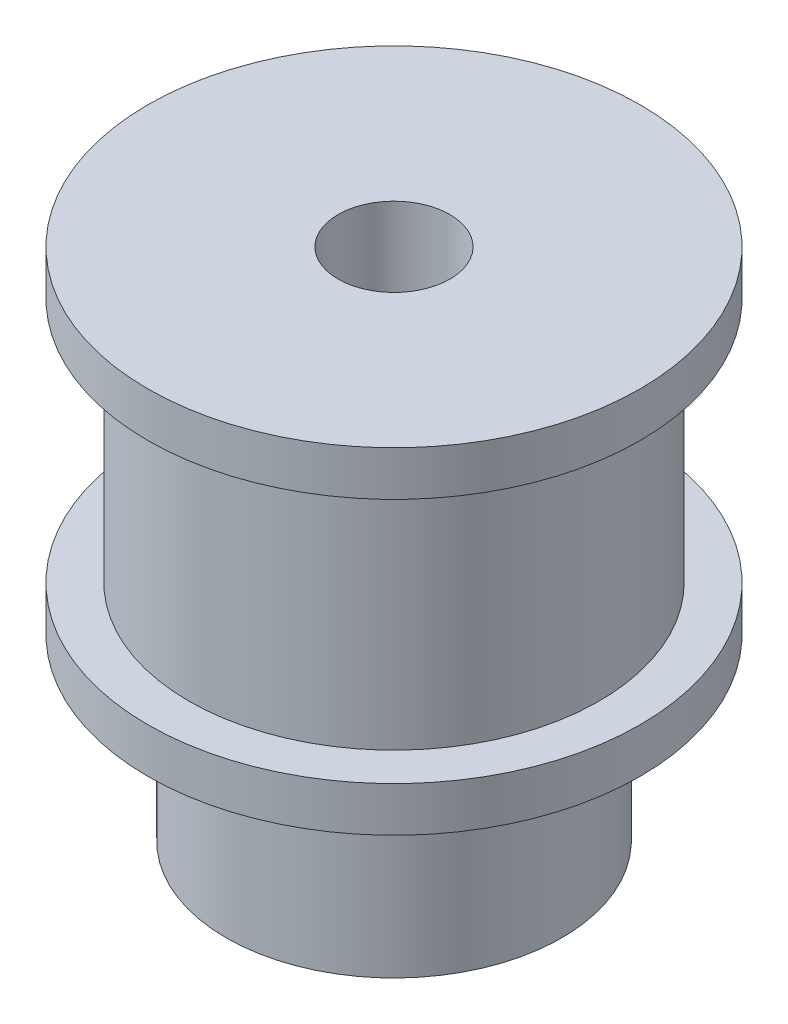
from build123d import *

# Parameters (mm, degrees)
SKETCH_1_R          = 11
EXTRUDE_1_DEPTH     = 2
SKETCH_2_R          = 9.17
EXTRUDE_2_DEPTH     = 11
SKETCH_3_R          = 11
EXTRUDE_3_DEPTH     = 2
SKETCH_4_R          = 2.5
CUT_EXTRUDE_1_DEPTH = 26
SKETCH_5_R          = 7.5
SKETCH_5_R_2        = 2.5
EXTRUDE_4_DEPTH     = 8


with BuildPart() as part:
    # 草图1 → 凸台-拉伸1 (new body)
    with BuildSketch(Plane(origin=(0, 0, 0), x_dir=(1, 0, 0), z_dir=(0, 1, 0))):
        with Locations(Location((0, 0, 0), (0, 0, 270))):
            Circle(SKETCH_1_R)
    extrude(amount=EXTRUDE_1_DEPTH)

    # 草图2 → 凸台-拉伸2 (add)
    with BuildSketch(Plane(origin=(0, 2, 0), x_dir=(1, 0, 0), z_dir=(0, 1, 0))):
        with Locations(Location((0, 0, 0), (0, 0, 270))):
            Circle(SKETCH_2_R)
    extrude(amount=EXTRUDE_2_DEPTH)

    # 草图3 → 凸台-拉伸3 (add)
    with BuildSketch(Plane(origin=(0, 13, 0), x_dir=(1, 0, 0), z_dir=(0, 1, 0))):
        with Locations(Location((0, 0, 0), (0, 0, 270))):
            Circle(SKETCH_3_R)
    extrude(amount=EXTRUDE_3_DEPTH)

    # 草图4 → 切除-拉伸1 (cut)
    with BuildSketch(Plane(origin=(0, 15, 0), x_dir=(1, 0, 0), z_dir=(0, 1, 0))):
        with Locations(Location((0, 0, 0), (0, 0, 270))):
            Circle(SKETCH_4_R)
    extrude(amount=-CUT_EXTRUDE_1_DEPTH, mode=Mode.SUBTRACT)

    # 草图5 → 凸台-拉伸4 (add)
    with BuildSketch(Plane.XZ):
        with Locations(Location((0, 0, 0), (0, 0, 270))):
            Circle(SKETCH_5_R)
        with Locations(Location((0, 0, 0), (0, 0, 90))):
            Circle(SKETCH_5_R_2, mode=Mode.SUBTRACT)
    extrude(amount=EXTRUDE_4_DEPTH)


solid = part.part
